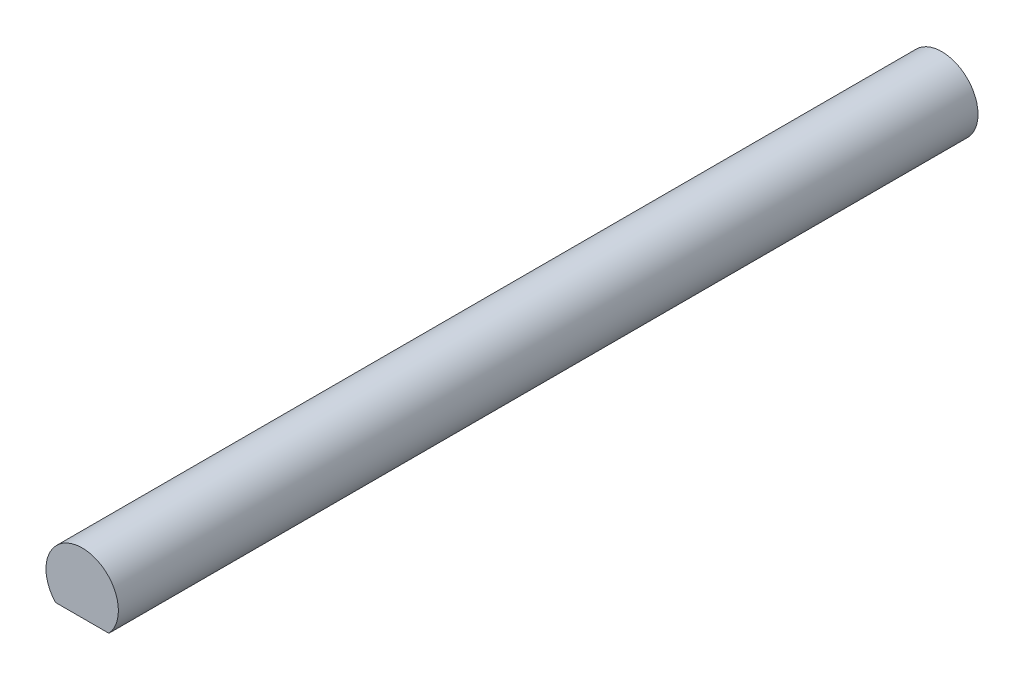
from build123d import *

# Parameters (mm, degrees)
AUFSATZ_LINEAR_AUSTRAGEN1_DEPTH = 47.5


with BuildPart() as part:
    # Skizze1 → Aufsatz-Linear austragen1 (new, symmetric)
    with BuildSketch(Plane.XY):
        with BuildLine():
            Line((-2.951270913, -2.7), (2.951270913, -2.7))
            ThreePointArc((2.951270913, -2.7), (0, 4), (-2.951270913, -2.7))
        make_face()
    extrude(amount=AUFSATZ_LINEAR_AUSTRAGEN1_DEPTH, both=True)


solid = part.part
